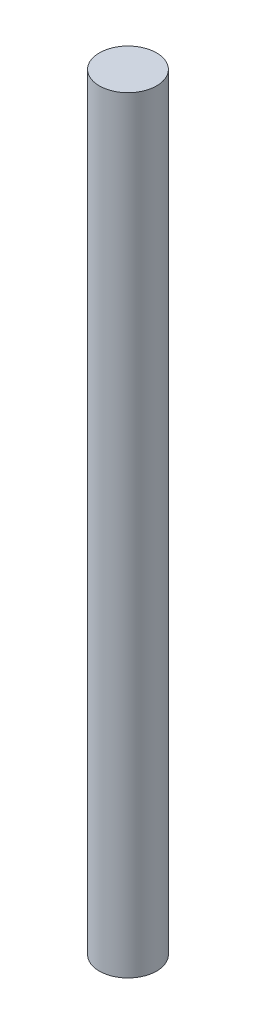
from build123d import *

# Parameters (mm, degrees)
SKETCH1_R           = 3.175
BOSS_EXTRUDE1_DEPTH = 85.09


with BuildPart() as part:
    # Sketch1 → Boss-Extrude1 (new body)
    with BuildSketch(Plane(origin=(0, 0, 0), x_dir=(1, 0, 0), z_dir=(0, 1, 0))):
        with Locations(Location((0, 0, 0), (0, 0, 270))):
            Circle(SKETCH1_R)
    extrude(amount=BOSS_EXTRUDE1_DEPTH)


solid = part.part
